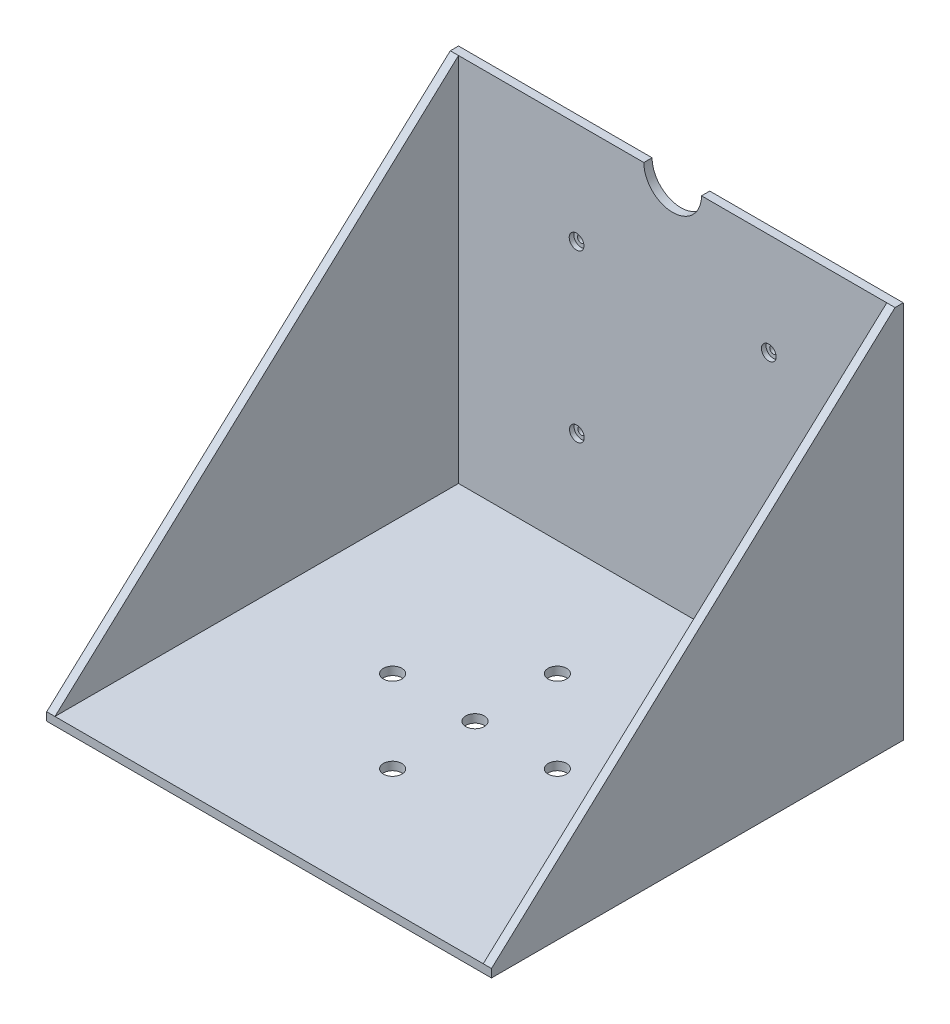
from build123d import *

# Parameters (mm, degrees)
CROQUIS1_W                                           = 108
CROQUIS1_H                                           = 100
SALIENTE_EXTRUIR2_DEPTH                              = 2
CROQUIS3_W                                           = 108
CROQUIS3_H                                           = 2
SALIENTE_EXTRUIR3_DEPTH                              = 90
CORTAR_EXTRUIR1_DEPTH                                = 90
TALADRO_DE_MARGEN_PARA_M42_D                         = 4.5
TALADRO_DE_MARGEN_PARA_M42_DEPTH                     = 10
TALADRO_DE_MARGEN_PARA_M42_TIP                       = 1.351936393
SALIENTE_EXTRUIR4_DEPTH                              = 2
SALIENTE_EXTRUIR5_DEPTH                              = 2
REFRENTADO_PARA_TORNILLO_CON_CABEZA_TRON_D           = 1.778
REFRENTADO_PARA_TORNILLO_CON_CABEZA_TRON_DEPTH       = 10
REFRENTADO_PARA_TORNILLO_CON_CABEZA_TRON_CBORE_D     = 3.57124
REFRENTADO_PARA_TORNILLO_CON_CABEZA_TRON_CBORE_DEPTH = 1.1176
REFRENTADO_PARA_TORNILLO_CON_CABEZA_TRON_TIP         = 0.53416509


with BuildPart() as part:
    # Croquis1 → Saliente-Extruir2 (new body)
    with BuildSketch(Plane(origin=(0, 0, 0), x_dir=(1, 0, 0), z_dir=(0, 1, 0))):
        Rectangle(CROQUIS1_W, CROQUIS1_H)
    extrude(amount=SALIENTE_EXTRUIR2_DEPTH)

    # Croquis3 → Saliente-Extruir3 (add)
    with BuildSketch(Plane(origin=(0, 2, 0), x_dir=(1, 0, 0), z_dir=(0, 1, 0))):
        with Locations((0, 49)):
            Rectangle(CROQUIS3_W, CROQUIS3_H)
    extrude(amount=SALIENTE_EXTRUIR3_DEPTH)

    # Croquis4 → Cortar-Extruir1 (cut)
    with BuildSketch(Plane.XY.offset(-48)):
        with BuildLine():
            Line((-7, 92), (7, 92))
            ThreePointArc((7, 92), (0, 85), (-7, 92))
        make_face()
    extrude(amount=-CORTAR_EXTRUIR1_DEPTH, mode=Mode.SUBTRACT)

    # Taladro de margen para M42
    with Locations(Plane(origin=(0, 0, 0), x_dir=(-1, 0, 0), z_dir=(0, -1, 0))):
        with Locations((0, 20), (-20, 0), (0, -20), (20, 0), (0, 0)):
            Hole(TALADRO_DE_MARGEN_PARA_M42_D / 2, depth=TALADRO_DE_MARGEN_PARA_M42_DEPTH)
            with Locations((0, 0, -(TALADRO_DE_MARGEN_PARA_M42_DEPTH + TALADRO_DE_MARGEN_PARA_M42_TIP / 2))):  # 118° drill point
                Cone(0, TALADRO_DE_MARGEN_PARA_M42_D / 2, TALADRO_DE_MARGEN_PARA_M42_TIP, mode=Mode.SUBTRACT)

    # Croquis19 → Saliente-Extruir4 (add)
    with BuildSketch(Plane(origin=(54, 0, 0), x_dir=(0, 0, -1), z_dir=(1, 0, 0))):
        Polygon((48, 92), (-50, 2), (48, 2), align=None)
    extrude(amount=-SALIENTE_EXTRUIR4_DEPTH)

    # Croquis20 → Saliente-Extruir5 (add)
    with BuildSketch(Plane.ZY.offset(54)):
        Polygon((50, 2), (-48, 2), (-48, 92), align=None)
    extrude(amount=-SALIENTE_EXTRUIR5_DEPTH)

    # Refrentado para tornillo con cabeza troncocónica de #01
    with Locations(Plane.XY.offset(-48)):
        with Locations((-23.335241647, 67.193959118), (23.34076456, 67.198738562), (-23.269344277, 26.863067453), (23.181350949, 26.939215525)):
            CounterBoreHole(REFRENTADO_PARA_TORNILLO_CON_CABEZA_TRON_D / 2, REFRENTADO_PARA_TORNILLO_CON_CABEZA_TRON_CBORE_D / 2, REFRENTADO_PARA_TORNILLO_CON_CABEZA_TRON_CBORE_DEPTH, depth=REFRENTADO_PARA_TORNILLO_CON_CABEZA_TRON_DEPTH)
            with Locations((0, 0, -(REFRENTADO_PARA_TORNILLO_CON_CABEZA_TRON_DEPTH + REFRENTADO_PARA_TORNILLO_CON_CABEZA_TRON_TIP / 2))):  # 118° drill point
                Cone(0, REFRENTADO_PARA_TORNILLO_CON_CABEZA_TRON_D / 2, REFRENTADO_PARA_TORNILLO_CON_CABEZA_TRON_TIP, mode=Mode.SUBTRACT)


solid = part.part
